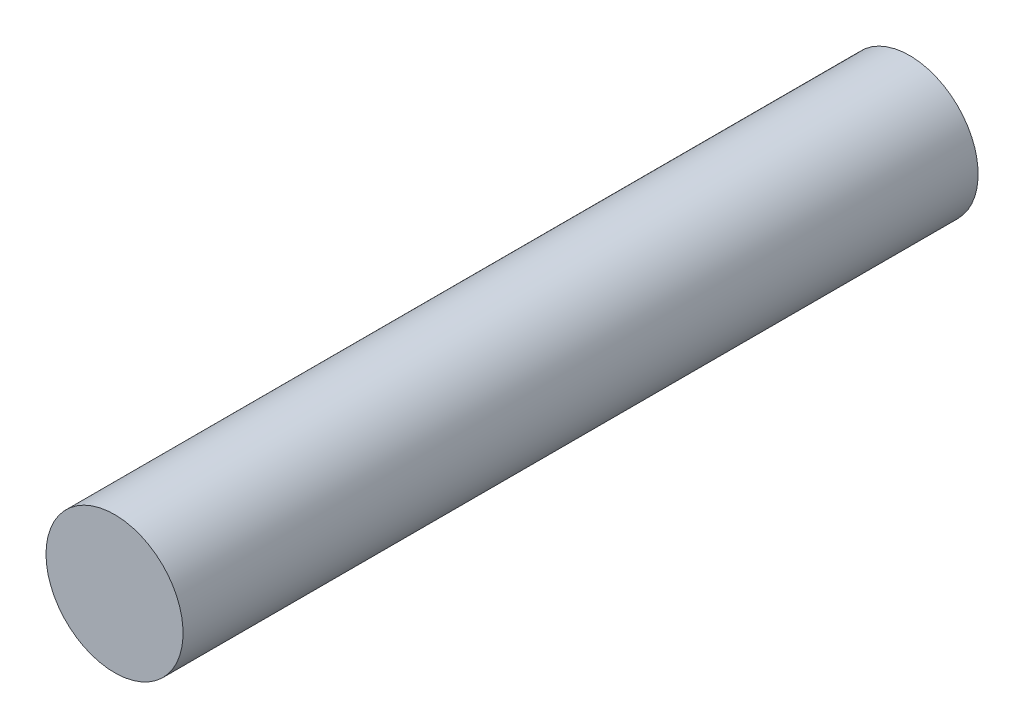
from build123d import *

# Parameters (mm, degrees)
SKETCH1_R           = 5
BOSS_EXTRUDE1_DEPTH = 58


with BuildPart() as part:
    # Sketch1 → Boss-Extrude1 (new body)
    with BuildSketch(Plane.XY):
        with Locations(Location((0, 0, 0), (0, 0, 180))):
            Circle(SKETCH1_R)
    extrude(amount=BOSS_EXTRUDE1_DEPTH)


solid = part.part
